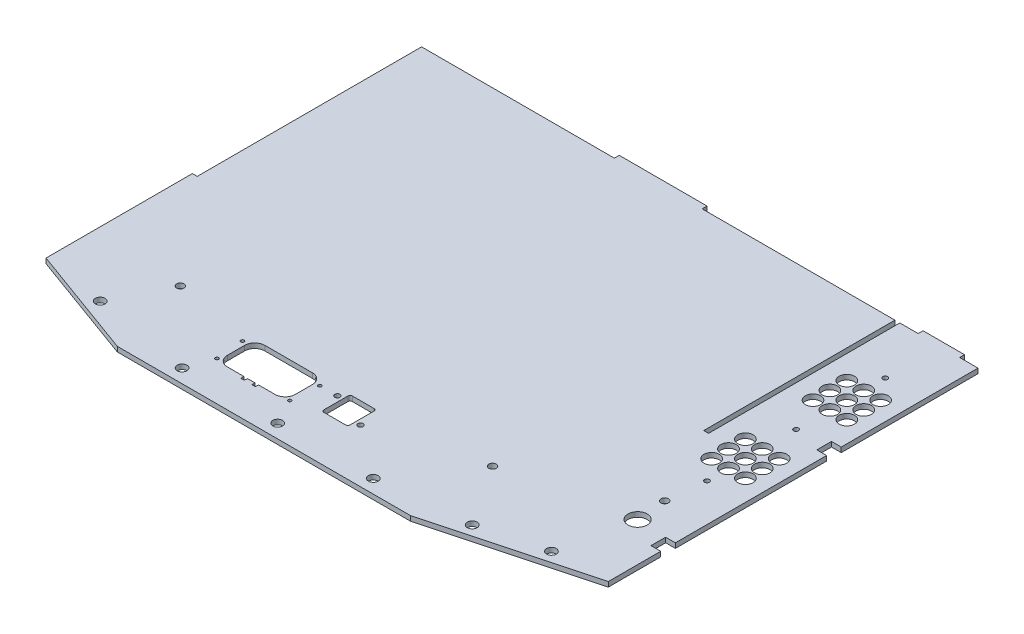
from build123d import *

# Parameters (mm, degrees)
SKETCH1_W                 = 308.08168
SKETCH1_H                 = 3.175
BOSS_EXTRUDE1_DEPTH       = 267.83
SKETCH3_W                 = 267.83
SKETCH3_H                 = 3.175
BOSS_EXTRUDE3_DEPTH       = 3.175
SKETCH4_W                 = 50.8889
SKETCH4_H                 = 3.175
BOSS_EXTRUDE4_DEPTH       = 267.83
CUT_EXTRUDE1_DEPTH        = 340.191055801
SKETCH19_R                = 5
CUT_EXTRUDE5_DEPTH        = 340.191055801
LPATTERN1_COUNT           = 3
LPATTERN1_PITCH           = 11
LPATTERN2_COUNT           = 3
LPATTERN2_PITCH           = 11
LPATTERN2_COPY_1_SKETCH_R = 5
LPATTERN2_COPY_1_DEPTH    = 340.191055801
LPATTERN2_COPY_2_SKETCH_R = 5
LPATTERN2_COPY_2_DEPTH    = 340.191055801
LPATTERN2_COPY_3_SKETCH_R = 5
LPATTERN2_COPY_3_DEPTH    = 340.191055801
LPATTERN2_COPY_4_SKETCH_R = 5
LPATTERN2_COPY_4_DEPTH    = 340.191055801
LPATTERN3_COUNT           = 2
LPATTERN3_PITCH           = 66
LPATTERN3_COPY_1_SKETCH_R = 5
LPATTERN3_COPY_1_DEPTH    = 340.191055801
LPATTERN3_COPY_2_SKETCH_R = 5
LPATTERN3_COPY_2_DEPTH    = 340.191055801
LPATTERN3_COPY_3_SKETCH_R = 5
LPATTERN3_COPY_3_DEPTH    = 340.191055801
LPATTERN3_COPY_4_SKETCH_R = 5
LPATTERN3_COPY_4_DEPTH    = 340.191055801
LPATTERN3_COPY_5_SKETCH_R = 5
LPATTERN3_COPY_5_DEPTH    = 340.191055801
LPATTERN3_COPY_6_SKETCH_R = 5
LPATTERN3_COPY_6_DEPTH    = 340.191055801
LPATTERN3_COPY_7_SKETCH_R = 5
LPATTERN3_COPY_7_DEPTH    = 340.191055801
LPATTERN3_COPY_8_SKETCH_R = 5
LPATTERN3_COPY_8_DEPTH    = 340.191055801
SKETCH21_W                = 267.83
SKETCH21_H                = 3.175
BOSS_EXTRUDE5_DEPTH       = 3.175
CUT_EXTRUDE3_DEPTH        = 340.191055801
SKETCH36_R                = 1.5875
CUT_EXTRUDE12_DEPTH       = 340.191055801
LPATTERN4_COUNT           = 3
LPATTERN4_PITCH           = 58
M4_CLEARANCE_HOLE1_D      = 4.8
SKETCH40_R                = 3.175
CUT_EXTRUDE13_DEPTH       = 340.191055801
CUT_EXTRUDE15_DEPTH       = 340.191055801
M3_CLEARANCE_HOLE1_D      = 3.4
SKETCH45_W                = 57.15
SKETCH45_H                = 3.175
SKETCH45_W_2              = 26.9875
BOSS_EXTRUDE6_DEPTH       = 3.175
SKETCH46_W                = 3.175
SKETCH46_H                = 124.4419914
CUT_EXTRUDE16_DEPTH       = 340.191055942
SKETCH47_W                = 3.175
SKETCH47_H                = 146.0243
CUT_EXTRUDE17_DEPTH       = 340.191055942
SKETCH48_W                = 6.35
SKETCH48_H                = 9.525
CUT_EXTRUDE18_DEPTH       = 340.191055942
SKETCH49_R                = 6.25
CUT_EXTRUDE19_DEPTH       = 340.191055942


with BuildPart() as part:
    # Sketch1 → Boss-Extrude1 (new body)
    with BuildSketch(Plane.XY):
        Rectangle(SKETCH1_W, SKETCH1_H)
    extrude(amount=BOSS_EXTRUDE1_DEPTH)

    # Sketch3 → Boss-Extrude3 (add)
    with BuildSketch(Plane(origin=(154.04084, 0, 0), x_dir=(0, 0, -1), z_dir=(1, 0, 0))):
        with Locations((-133.915, 0)):
            Rectangle(SKETCH3_W, SKETCH3_H)
    extrude(amount=BOSS_EXTRUDE3_DEPTH)

    # Sketch4 → Boss-Extrude4 (add)
    with BuildSketch(Plane.XY.offset(267.83)):
        with Locations((182.66029, 0)):
            Rectangle(SKETCH4_W, SKETCH4_H)
    extrude(amount=-BOSS_EXTRUDE4_DEPTH)

    # Sketch6 → Cut-Extrude1 (cut, through all)
    with BuildSketch(Plane(origin=(0, 1.5875, 0), x_dir=(1, 0, 0), z_dir=(0, 1, 0))):
        Polygon((208.10474, -240.606362049), (106.50474, -267.83), (208.10474, -267.83), align=None)
    extrude(amount=-CUT_EXTRUDE1_DEPTH, mode=Mode.SUBTRACT)

    # Sketch19 → Cut-Extrude5 (cut, through all)
    with BuildSketch(Plane(origin=(0, 1.5875, 0), x_dir=(1, 0, 0), z_dir=(0, 1, 0))):
        with Locations(Location((172.48674, -49.774823778, 0), (0, 0, 270))):
            Circle(SKETCH19_R)
    cut_extrude5 = extrude(amount=-CUT_EXTRUDE5_DEPTH, mode=Mode.SUBTRACT)

    # LPattern1: Cut-Extrude5 ×3
    with Locations(*[(i * LPATTERN1_PITCH, 0, 0) for i in range(1, LPATTERN1_COUNT)]):
        add(cut_extrude5, mode=Mode.SUBTRACT)

    # LPattern2: Cut-Extrude5 ×3
    with Locations(*[(0, 0, i * LPATTERN2_PITCH) for i in range(1, LPATTERN2_COUNT)]):
        add(cut_extrude5, mode=Mode.SUBTRACT)

    # LPattern2 copy 1 sketch → LPattern2 copy 1 (cut, through all)
    with BuildSketch(Plane(origin=(11, 1.5875, 11), x_dir=(1, 0, 0), z_dir=(0, 1, 0))):
        with Locations(Location((172.48674, -49.774823778, 0), (0, 0, 270))):
            Circle(LPATTERN2_COPY_1_SKETCH_R)
    extrude(amount=-LPATTERN2_COPY_1_DEPTH, mode=Mode.SUBTRACT)

    # LPattern2 copy 2 sketch → LPattern2 copy 2 (cut, through all)
    with BuildSketch(Plane(origin=(11, 1.5875, 22), x_dir=(1, 0, 0), z_dir=(0, 1, 0))):
        with Locations(Location((172.48674, -49.774823778, 0), (0, 0, 270))):
            Circle(LPATTERN2_COPY_2_SKETCH_R)
    extrude(amount=-LPATTERN2_COPY_2_DEPTH, mode=Mode.SUBTRACT)

    # LPattern2 copy 3 sketch → LPattern2 copy 3 (cut, through all)
    with BuildSketch(Plane(origin=(22, 1.5875, 11), x_dir=(1, 0, 0), z_dir=(0, 1, 0))):
        with Locations(Location((172.48674, -49.774823778, 0), (0, 0, 270))):
            Circle(LPATTERN2_COPY_3_SKETCH_R)
    extrude(amount=-LPATTERN2_COPY_3_DEPTH, mode=Mode.SUBTRACT)

    # LPattern2 copy 4 sketch → LPattern2 copy 4 (cut, through all)
    with BuildSketch(Plane(origin=(22, 1.5875, 22), x_dir=(1, 0, 0), z_dir=(0, 1, 0))):
        with Locations(Location((172.48674, -49.774823778, 0), (0, 0, 270))):
            Circle(LPATTERN2_COPY_4_SKETCH_R)
    extrude(amount=-LPATTERN2_COPY_4_DEPTH, mode=Mode.SUBTRACT)

    # LPattern3: Cut-Extrude5 ×2
    with Locations(*[(0, 0, i * LPATTERN3_PITCH) for i in range(1, LPATTERN3_COUNT)]):
        add(cut_extrude5, mode=Mode.SUBTRACT)

    # LPattern3 copy 1 sketch → LPattern3 copy 1 (cut, through all)
    with BuildSketch(Plane(origin=(11, 1.5875, 66), x_dir=(1, 0, 0), z_dir=(0, 1, 0))):
        with Locations(Location((172.48674, -49.774823778, 0), (0, 0, 270))):
            Circle(LPATTERN3_COPY_1_SKETCH_R)
    extrude(amount=-LPATTERN3_COPY_1_DEPTH, mode=Mode.SUBTRACT)

    # LPattern3 copy 2 sketch → LPattern3 copy 2 (cut, through all)
    with BuildSketch(Plane(origin=(22, 1.5875, 66), x_dir=(1, 0, 0), z_dir=(0, 1, 0))):
        with Locations(Location((172.48674, -49.774823778, 0), (0, 0, 270))):
            Circle(LPATTERN3_COPY_2_SKETCH_R)
    extrude(amount=-LPATTERN3_COPY_2_DEPTH, mode=Mode.SUBTRACT)

    # LPattern3 copy 3 sketch → LPattern3 copy 3 (cut, through all)
    with BuildSketch(Plane(origin=(0, 1.5875, 77), x_dir=(1, 0, 0), z_dir=(0, 1, 0))):
        with Locations(Location((172.48674, -49.774823778, 0), (0, 0, 270))):
            Circle(LPATTERN3_COPY_3_SKETCH_R)
    extrude(amount=-LPATTERN3_COPY_3_DEPTH, mode=Mode.SUBTRACT)

    # LPattern3 copy 4 sketch → LPattern3 copy 4 (cut, through all)
    with BuildSketch(Plane(origin=(0, 1.5875, 88), x_dir=(1, 0, 0), z_dir=(0, 1, 0))):
        with Locations(Location((172.48674, -49.774823778, 0), (0, 0, 270))):
            Circle(LPATTERN3_COPY_4_SKETCH_R)
    extrude(amount=-LPATTERN3_COPY_4_DEPTH, mode=Mode.SUBTRACT)

    # LPattern3 copy 5 sketch → LPattern3 copy 5 (cut, through all)
    with BuildSketch(Plane(origin=(11, 1.5875, 77), x_dir=(1, 0, 0), z_dir=(0, 1, 0))):
        with Locations(Location((172.48674, -49.774823778, 0), (0, 0, 270))):
            Circle(LPATTERN3_COPY_5_SKETCH_R)
    extrude(amount=-LPATTERN3_COPY_5_DEPTH, mode=Mode.SUBTRACT)

    # LPattern3 copy 6 sketch → LPattern3 copy 6 (cut, through all)
    with BuildSketch(Plane(origin=(11, 1.5875, 88), x_dir=(1, 0, 0), z_dir=(0, 1, 0))):
        with Locations(Location((172.48674, -49.774823778, 0), (0, 0, 270))):
            Circle(LPATTERN3_COPY_6_SKETCH_R)
    extrude(amount=-LPATTERN3_COPY_6_DEPTH, mode=Mode.SUBTRACT)

    # LPattern3 copy 7 sketch → LPattern3 copy 7 (cut, through all)
    with BuildSketch(Plane(origin=(22, 1.5875, 77), x_dir=(1, 0, 0), z_dir=(0, 1, 0))):
        with Locations(Location((172.48674, -49.774823778, 0), (0, 0, 270))):
            Circle(LPATTERN3_COPY_7_SKETCH_R)
    extrude(amount=-LPATTERN3_COPY_7_DEPTH, mode=Mode.SUBTRACT)

    # LPattern3 copy 8 sketch → LPattern3 copy 8 (cut, through all)
    with BuildSketch(Plane(origin=(22, 1.5875, 88), x_dir=(1, 0, 0), z_dir=(0, 1, 0))):
        with Locations(Location((172.48674, -49.774823778, 0), (0, 0, 270))):
            Circle(LPATTERN3_COPY_8_SKETCH_R)
    extrude(amount=-LPATTERN3_COPY_8_DEPTH, mode=Mode.SUBTRACT)

    # Sketch21 → Boss-Extrude5 (add)
    with BuildSketch(Plane.ZY.offset(154.04084)):
        with Locations((133.915, 0)):
            Rectangle(SKETCH21_W, SKETCH21_H)
    extrude(amount=BOSS_EXTRUDE5_DEPTH)

    # Sketch11 → Cut-Extrude3 (cut, through all)
    with BuildSketch(Plane.XZ.offset(1.5875)):
        Polygon((-157.21584, 241.2743), (-84.254653892, 267.83), (-157.21584, 267.83), align=None)
    extrude(amount=-CUT_EXTRUDE3_DEPTH, mode=Mode.SUBTRACT)

    # Sketch36 → Cut-Extrude12 (cut, symmetric)
    with BuildSketch(Plane(origin=(0, 1.5875, 0), x_dir=(1, 0, 0), z_dir=(0, 1, 0))):
        with Locations(Location((183.48674, -35.774823778, 0), (0, 0, 270))):
            Circle(SKETCH36_R)
    cut_extrude12 = extrude(amount=CUT_EXTRUDE12_DEPTH, both=True, mode=Mode.SUBTRACT)

    # LPattern4: Cut-Extrude12 ×3
    with Locations(*[(0, 0, i * LPATTERN4_PITCH) for i in range(1, LPATTERN4_COUNT)]):
        add(cut_extrude12, mode=Mode.SUBTRACT)

    # M4 Clearance Hole1 (through all)
    with Locations(Plane(origin=(0, 1.5875, 0), x_dir=(1, 0, 0), z_dir=(0, 1, 0))):
        with Locations((180.96500002, -176.776), (105.42905, -213.2849914), (-97.77095, -213.2849914)):
            Hole(M4_CLEARANCE_HOLE1_D / 2)

    # Sketch40 → Cut-Extrude13 (cut, through all)
    with BuildSketch(Plane(origin=(0, 1.5875, 0), x_dir=(1, 0, 0), z_dir=(0, 1, 0))):
        with Locations(Location((172.54474, -242.09298883, 0), (0, 0, 270))):
            Circle(SKETCH40_R)
        with Locations(Location((131.90474, -252.982444011, 0), (0, 0, 270))):
            Circle(SKETCH40_R)
        with Locations(Location((73.48474, -258.94, 0), (0, 0, 270))):
            Circle(SKETCH40_R)
        with Locations(Location((11.25474, -258.94, 0), (0, 0, 270))):
            Circle(SKETCH40_R)
        with Locations(Location((-50.97526, -258.94, 0), (0, 0, 270))):
            Circle(SKETCH40_R)
        with Locations(Location((-115.322188641, -247.921359373, 0), (0, 0, 270))):
            Circle(SKETCH40_R)
    extrude(amount=-CUT_EXTRUDE13_DEPTH, mode=Mode.SUBTRACT)

    # Sketch41 → Cut-Extrude15 (cut, through all)
    with BuildSketch(Plane(origin=(0, 1.5875, 0), x_dir=(1, 0, 0), z_dir=(0, 1, 0))):
        with BuildLine():
            Line((34.291998123, -219.319811977), (20.241998123, -219.319811977))
            add(Edge.make_bspline(
                [(20.241998123, -219.319811977), (20.05700587, -219.319811977), (19.695257967, -219.383443925), (19.162187461, -219.721001314), (18.824630071, -220.254071821), (18.760998123, -220.615819723), (18.760998123, -220.800811977)],
                knots=[0, 0, 0, 0, 0.25, 0.5, 0.75, 1, 1, 1, 1], degree=3))
            Line((18.760998123, -220.800811977), (18.760998123, -236.350811977))
            add(Edge.make_bspline(
                [(18.760998123, -236.350811977), (18.760998123, -236.53580423), (18.824630071, -236.897552133), (19.162187461, -237.430622639), (19.695257967, -237.768180028), (20.05700587, -237.831811977), (20.241998123, -237.831811977)],
                knots=[0, 0, 0, 0, 0.25, 0.5, 0.75, 1, 1, 1, 1], degree=3))
            Line((20.241998123, -237.831811977), (34.291998123, -237.831811977))
            add(Edge.make_bspline(
                [(34.291998123, -237.831811977), (34.476990376, -237.831811977), (34.838738279, -237.768180028), (35.371808785, -237.430622639), (35.709366175, -236.897552133), (35.772998123, -236.53580423), (35.772998123, -236.350811977)],
                knots=[0, 0, 0, 0, 0.25, 0.5, 0.75, 1, 1, 1, 1], degree=3))
            Line((35.772998123, -236.350811977), (35.772998123, -220.800811977))
            add(Edge.make_bspline(
                [(35.772998123, -220.800811977), (35.772998123, -220.615819723), (35.709366175, -220.254071821), (35.371808785, -219.721001314), (34.838738279, -219.383443925), (34.476990376, -219.319811977), (34.291998123, -219.319811977)],
                knots=[0, 0, 0, 0, 0.25, 0.5, 0.75, 1, 1, 1, 1], degree=3))
        make_face()
        with BuildLine():
            Line((-43.386072906, -225.830806026), (-43.386072906, -237.030806026))
            add(Edge.make_bspline(
                [(-43.386072906, -237.030806026), (-43.386072906, -237.431648795), (-43.316837193, -238.217289831), (-42.85331251, -239.876692243), (-41.596147178, -241.821880297), (-39.650959124, -243.07904563), (-37.991556712, -243.542570312), (-37.205915676, -243.611806026), (-36.805072906, -243.611806026)],
                knots=[0, 0, 0, 0, 0.125, 0.25, 0.5, 0.75, 0.875, 1, 1, 1, 1], degree=3))
            Line((-36.805072906, -243.611806026), (-26.154195078, -243.611806026))
            Line((-26.154195078, -243.611806026), (-25.979217705, -245.611806196))
            Line((-25.979217705, -245.611806196), (-23.830927999, -245.611806196))
            Line((-23.830927999, -245.611806196), (-23.655950719, -243.611806026))
            Line((-23.655950719, -243.611806026), (-18.954195078, -243.611806026))
            Line((-18.954195078, -243.611806026), (-18.779217705, -245.611806196))
            Line((-18.779217705, -245.611806196), (-16.630927999, -245.611806196))
            Line((-16.630927999, -245.611806196), (-16.455950719, -243.611806026))
            Line((-16.455950719, -243.611806026), (-5.805072906, -243.611806026))
            add(Edge.make_bspline(
                [(-5.805072906, -243.611806026), (-5.404230137, -243.611806026), (-4.618589101, -243.542570312), (-2.959186689, -243.07904563), (-1.013998635, -241.821880297), (0.243166697, -239.876692243), (0.70669138, -238.217289831), (0.775927094, -237.431648795), (0.775927094, -237.030806026)],
                knots=[0, 0, 0, 0, 0.125, 0.25, 0.5, 0.75, 0.875, 1, 1, 1, 1], degree=3))
            Line((0.775927094, -237.030806026), (0.775927094, -225.830806026))
            add(Edge.make_bspline(
                [(0.775927094, -225.830806026), (0.775927094, -225.429963257), (0.70669138, -224.64432222), (0.243166697, -222.984919809), (-1.013998635, -221.039731755), (-2.959186689, -219.782566422), (-4.618589101, -219.319041739), (-5.404230137, -219.249806026), (-5.805072906, -219.249806026)],
                knots=[0, 0, 0, 0, 0.125, 0.25, 0.5, 0.75, 0.875, 1, 1, 1, 1], degree=3))
            Line((-5.805072906, -219.249806026), (-36.805072906, -219.249806026))
            add(Edge.make_bspline(
                [(-36.805072906, -219.249806026), (-37.205915676, -219.249806026), (-37.991556712, -219.319041739), (-39.650959124, -219.782566422), (-41.596147178, -221.039731755), (-42.85331251, -222.984919809), (-43.316837193, -224.64432222), (-43.386072906, -225.429963257), (-43.386072906, -225.830806026)],
                knots=[0, 0, 0, 0, 0.125, 0.25, 0.5, 0.75, 0.875, 1, 1, 1, 1], degree=3))
        make_face()
        with BuildLine():
            add(Edge.make_bspline(
                [(1.309927323, -242.230806868), (1.309927323, -240.060806868), (3.479927323, -240.060806868), (3.479927323, -242.230806868)],
                knots=[0, 0, 0, 0, 1, 1, 1, 1], degree=3, weights=[1, 0.333333333, 0.333333333, 1]))
            add(Edge.make_bspline(
                [(3.479927323, -242.230806868), (3.479927323, -244.400806868), (1.309927323, -244.400806868), (1.309927323, -242.230806868)],
                knots=[0, 0, 0, 0, 1, 1, 1, 1], degree=3, weights=[1, 0.333333333, 0.333333333, 1]))
        make_face()
        with BuildLine():
            add(Edge.make_bspline(
                [(2.809927323, -224.130806868), (2.809927323, -221.960806868), (4.979927323, -221.960806868), (4.979927323, -224.130806868)],
                knots=[0, 0, 0, 0, 1, 1, 1, 1], degree=3, weights=[1, 0.333333333, 0.333333333, 1]))
            add(Edge.make_bspline(
                [(4.979927323, -224.130806868), (4.979927323, -226.300806868), (2.809927323, -226.300806868), (2.809927323, -224.130806868)],
                knots=[0, 0, 0, 0, 1, 1, 1, 1], degree=3, weights=[1, 0.333333333, 0.333333333, 1]))
        make_face()
        with BuildLine():
            add(Edge.make_bspline(
                [(-46.090072677, -242.230806868), (-46.090072677, -240.060806868), (-43.920072677, -240.060806868), (-43.920072677, -242.230806868)],
                knots=[0, 0, 0, 0, 1, 1, 1, 1], degree=3, weights=[1, 0.333333333, 0.333333333, 1]))
            add(Edge.make_bspline(
                [(-43.920072677, -242.230806868), (-43.920072677, -244.400806868), (-46.090072677, -244.400806868), (-46.090072677, -242.230806868)],
                knots=[0, 0, 0, 0, 1, 1, 1, 1], degree=3, weights=[1, 0.333333333, 0.333333333, 1]))
        make_face()
        with BuildLine():
            add(Edge.make_bspline(
                [(-45.420072677, -224.130806868), (-45.420072677, -226.300806868), (-47.590072677, -226.300806868), (-47.590072677, -224.130806868)],
                knots=[0, 0, 0, 0, 1, 1, 1, 1], degree=3, weights=[1, 0.333333333, 0.333333333, 1]))
            add(Edge.make_bspline(
                [(-47.590072677, -224.130806868), (-47.590072677, -221.960806868), (-45.420072677, -221.960806868), (-45.420072677, -224.130806868)],
                knots=[0, 0, 0, 0, 1, 1, 1, 1], degree=3, weights=[1, 0.333333333, 0.333333333, 1]))
        make_face()
    extrude(amount=-CUT_EXTRUDE15_DEPTH, mode=Mode.SUBTRACT)

    # M3 Clearance Hole1 (through all)
    with Locations(Plane(origin=(0, 1.5875, 0), x_dir=(1, 0, 0), z_dir=(0, 1, 0))):
        with Locations((39.266998249, -233.075811977), (15.266998249, -224.075811977)):
            Hole(M3_CLEARANCE_HOLE1_D / 2)

    # Sketch45 → Boss-Extrude6 (add)
    with BuildSketch(Plane(origin=(0, 0, 0), x_dir=(-1, 0, 0), z_dir=(0, 0, -1))):
        Rectangle(SKETCH45_W, SKETCH45_H)
        with Locations((-182.66100002, 0)):
            Rectangle(SKETCH45_W_2, SKETCH45_H)
    extrude(amount=BOSS_EXTRUDE6_DEPTH)

    # Sketch46 → Cut-Extrude16 (cut, through all)
    with BuildSketch(Plane(origin=(0, 1.5875, 0), x_dir=(1, 0, 0), z_dir=(0, 1, 0))):
        with Locations((155.62850002, -62.2209957)):
            Rectangle(SKETCH46_W, SKETCH46_H)
    extrude(amount=-CUT_EXTRUDE16_DEPTH, mode=Mode.SUBTRACT)

    # Sketch47 → Cut-Extrude17 (cut, through all)
    with BuildSketch(Plane(origin=(0, 1.5875, 0), x_dir=(1, 0, 0), z_dir=(0, 1, 0))):
        with Locations((-155.62834, -73.01215)):
            Rectangle(SKETCH47_W, SKETCH47_H)
    extrude(amount=-CUT_EXTRUDE17_DEPTH, mode=Mode.SUBTRACT)

    # Sketch48 → Cut-Extrude18 (cut, through all)
    with BuildSketch(Plane(origin=(0, 1.5875, 0), x_dir=(1, 0, 0), z_dir=(0, 1, 0))):
        with Locations((204.92974, -201.724823778)):
            Rectangle(SKETCH48_W, SKETCH48_H)
        with Locations((204.92974, -93.774823778)):
            Rectangle(SKETCH48_W, SKETCH48_H)
    extrude(amount=-CUT_EXTRUDE18_DEPTH, mode=Mode.SUBTRACT)

    # Sketch49 → Cut-Extrude19 (cut, through all)
    with BuildSketch(Plane(origin=(0, 1.5875, 0), x_dir=(1, 0, 0), z_dir=(0, 1, 0))):
        with Locations(Location((182.66100002, -196.101, 0), (0, 0, 270))):
            Circle(SKETCH49_R)
    extrude(amount=-CUT_EXTRUDE19_DEPTH, mode=Mode.SUBTRACT)


solid = part.part
